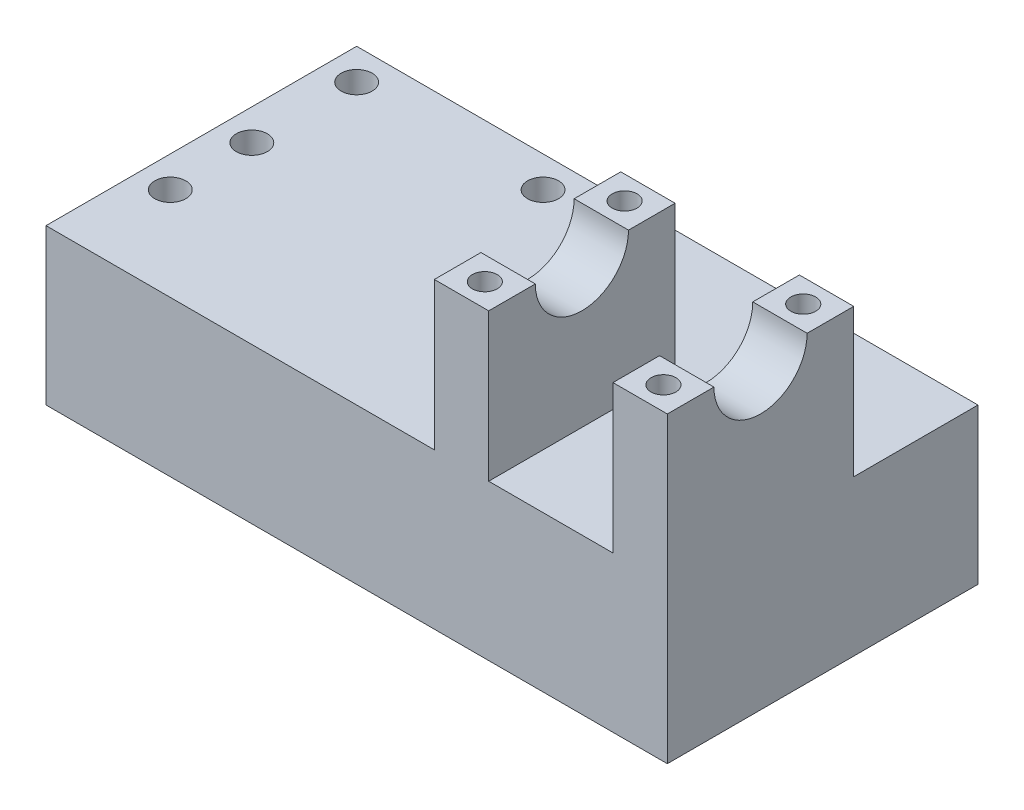
from build123d import *

# Parameters (mm, degrees)
SKETCH_1_W                   = 80
SKETCH_1_H                   = 40
EXTRUDE_1_DEPTH              = 20
HOLE_WIZARD_M3_1_D           = 4
HOLE_WIZARD_M3_1_CBORE_D     = 7
HOLE_WIZARD_M3_1_CBORE_DEPTH = 7
SKETCH_6_W                   = 7
SKETCH_6_H                   = 24
EXTRUDE_2_DEPTH              = 19
CUT_EXTRUDE_1_REACH          = 76.973
SKETCH_7_R                   = 6
SKETCH_16_R                  = 1.6
CUT_EXTRUDE_2_DEPTH          = 39
CUT_EXTRUDE_3_DEPTH          = 6


with BuildPart() as part:
    # 草图1 → 凸台-拉伸1 (new body)
    with BuildSketch(Plane(origin=(0, 0, 0), x_dir=(1, 0, 0), z_dir=(0, 1, 0))):
        with Locations((40, -20)):
            Rectangle(SKETCH_1_W, SKETCH_1_H)
    extrude(amount=EXTRUDE_1_DEPTH)

    # M3 六角圆柱头螺钉的柱形沉头孔1 (through all)
    with Locations(Plane(origin=(0, 0, 0), x_dir=(-1, 0, 0), z_dir=(0, -1, 0))):
        with Locations((-4, -4), (-4, -17.5), (-4, -28), (-28, -4)):
            CounterBoreHole(HOLE_WIZARD_M3_1_D / 2, HOLE_WIZARD_M3_1_CBORE_D / 2, HOLE_WIZARD_M3_1_CBORE_DEPTH)

    # 草图6 → 凸台-拉伸2 (add)
    with BuildSketch(Plane(origin=(0, 20, 0), x_dir=(1, 0, 0), z_dir=(0, 1, 0))):
        with Locations((53.5, -28)):
            Rectangle(SKETCH_6_W, SKETCH_6_H)
        with Locations((76.5, -28)):
            Rectangle(SKETCH_6_W, SKETCH_6_H)
    extrude(amount=EXTRUDE_2_DEPTH)

    # 切除-拉伸1: up to this face of the body (flat: up to its plane)
    cut_extrude_1_end = Plane(part.part.faces().sort_by_distance((80, 17.079617834, 22.904458599))[0])
    # 草图7 → 切除-拉伸1 (cut, up to the picked face)
    with BuildSketch(Plane.ZY.offset(-50), mode=Mode.PRIVATE) as cut_extrude_1_sk1:
        with Locations((28, 39)):
            Circle(SKETCH_7_R)
    cut_extrude_1_tool1 = split(extrude(cut_extrude_1_sk1.sketch, amount=-CUT_EXTRUDE_1_REACH, mode=Mode.PRIVATE), bisect_by=cut_extrude_1_end, keep=Keep.BOTH, mode=Mode.PRIVATE)
    add(cut_extrude_1_tool1.solids().sort_by(Axis((50, 39, 28), (1, 0, 0)))[0], mode=Mode.SUBTRACT)

    # 草图16 → 切除-拉伸2 (cut)
    with BuildSketch(Plane(origin=(0, 39, 0), x_dir=(1, 0, 0), z_dir=(0, 1, 0))):
        with Locations(Location((53.5, -37, 0), (0, 0, 270))):
            Circle(SKETCH_16_R)
        with Locations(Location((53.5, -19, 0), (0, 0, 270))):
            Circle(SKETCH_16_R)
        with Locations(Location((76.5, -19, 0), (0, 0, 270))):
            Circle(SKETCH_16_R)
        with Locations(Location((76.5, -37, 0), (0, 0, 270))):
            Circle(SKETCH_16_R)
    extrude(amount=-CUT_EXTRUDE_2_DEPTH, mode=Mode.SUBTRACT)

    # 草图17 → 切除-拉伸3 (cut)
    with BuildSketch(Plane.XZ):
        Polygon((56.733161507, 37), (55.116580754, 39.8), (51.883419246, 39.8), (50.266838493, 37), (51.883419246, 34.2), (55.116580754, 34.2), align=None)
        Polygon((73.266843837, 37.005878434), (74.878331045, 34.202943845), (78.111487208, 34.197065411), (79.733156163, 36.994121566), (78.121668955, 39.797056155), (74.888512792, 39.802934589), align=None)
        Polygon((56.733161283, 18.998795225), (55.117624008, 21.799397418), (51.884462725, 21.800602193), (50.266838717, 19.001204775), (51.882375992, 16.200602582), (55.115537275, 16.199397807), align=None)
        Polygon((79.733152762, 18.992479982), (78.123088908, 21.796232417), (74.889936146, 21.803752435), (73.266847238, 19.007520018), (74.876911092, 16.203767583), (78.110063854, 16.196247565), align=None)
    extrude(amount=-CUT_EXTRUDE_3_DEPTH, mode=Mode.SUBTRACT)


solid = part.part
